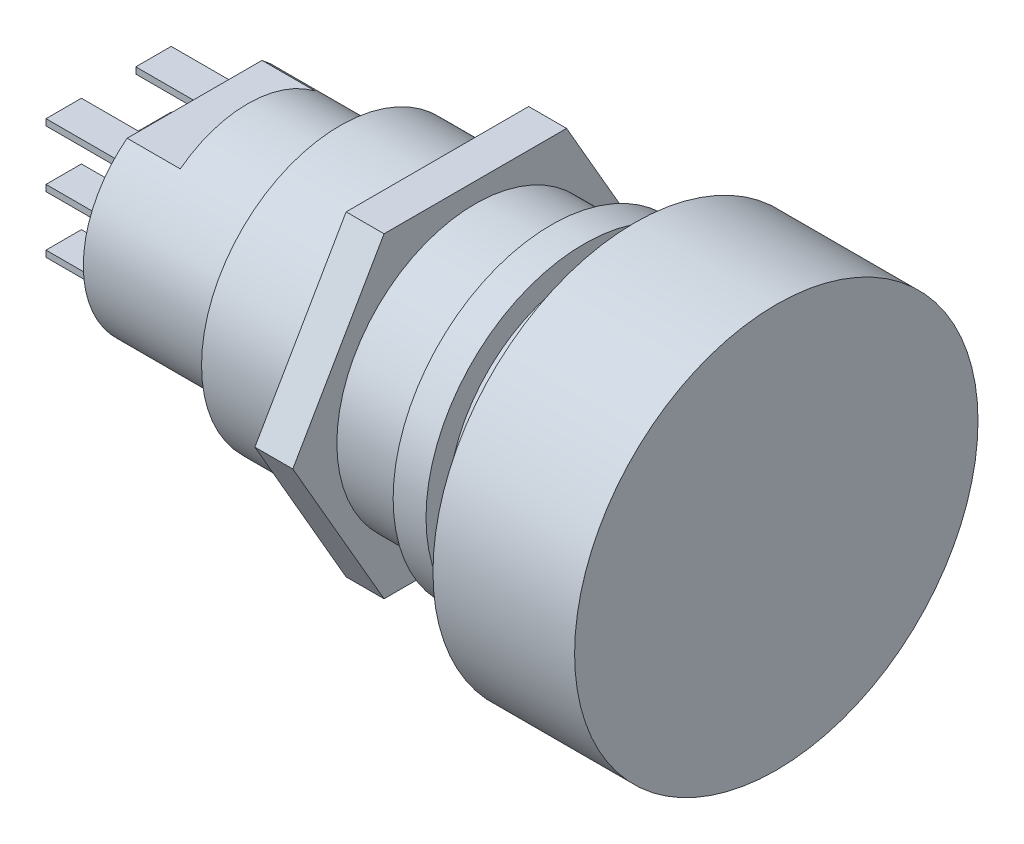
from build123d import *

# Parameters (mm, degrees)
ESQUISSE4_W             = 10.6658333
ESQUISSE4_H             = 2.673862607
ENL_V_MAT_EXTRU_1_DEPTH = 4.2
ESQUISSE3_W             = 2.8
ESQUISSE3_H             = 0.5
BOSS_EXTRU_1_DEPTH      = 6.8
BOSS_EXTRU_2_START      = 6
ESQUISSE5_R             = 10.95
BOSS_EXTRU_2_DEPTH      = 3


with BuildPart() as part:
    # Esquisse2 → Révolution1 (revolve)
    with BuildSketch(Plane.XY, mode=Mode.PRIVATE) as r_volution1_sk:
        Polygon((0, 10.95), (0, 8.8), (-11.5, 8.8), (-11.5, 0), (0, 0), (34.5, 0), (34.5, 15.95), (23.3, 15.95), (23.3, 10.75), (19.3, 10.75), (19.3, 12.5), (16.7, 12.5), (16.7, 10.95), align=None)
    revolve(r_volution1_sk.sketch.rotate(Axis((0, 0, 0), (1, 0, 0)), 90), axis=Axis((0, 0, 0), (1, 0, 0)))

    # Esquisse4 → Enlèv. mat.-Extru.1 (cut)
    with BuildSketch(Plane.ZY.offset(11.5)):
        with Locations((0, 8.336931304)):
            Rectangle(ESQUISSE4_W, ESQUISSE4_H)
        with Locations((0, -8.336931304)):
            Rectangle(ESQUISSE4_W, ESQUISSE4_H)
    extrude(amount=-ENL_V_MAT_EXTRU_1_DEPTH, mode=Mode.SUBTRACT)

    # Esquisse3 → Boss.-Extru.1 (add)
    with BuildSketch(Plane(origin=(-11.5, 0, 0), x_dir=(0, 0, -1), z_dir=(1, 0, 0))):
        with Locations((3.55, 4.5)):
            Rectangle(ESQUISSE3_W, ESQUISSE3_H)
        with Locations((3.55, 0)):
            Rectangle(ESQUISSE3_W, ESQUISSE3_H)
        with Locations((3.55, -4.5)):
            Rectangle(ESQUISSE3_W, ESQUISSE3_H)
        with Locations((-3.55, 0)):
            Rectangle(ESQUISSE3_W, ESQUISSE3_H)
        with Locations((-3.55, -4.5)):
            Rectangle(ESQUISSE3_W, ESQUISSE3_H)
        with Locations((-3.55, 4.5)):
            Rectangle(ESQUISSE3_W, ESQUISSE3_H)
    extrude(amount=-BOSS_EXTRU_1_DEPTH)


with BuildPart() as body_2:
    # Esquisse5 → Boss.-Extru.2 (new body)
    with BuildSketch(Plane.ZY.offset(-16.7).offset(BOSS_EXTRU_2_START)):
        Polygon((7.216878365, 12.5), (-7.216878365, 12.5), (-14.43375673, 0), (-7.216878365, -12.5), (7.216878365, -12.5), (14.43375673, 0), align=None)
        Circle(ESQUISSE5_R, mode=Mode.SUBTRACT)
    extrude(amount=BOSS_EXTRU_2_DEPTH)


solid = Compound([part.part, body_2.part])
